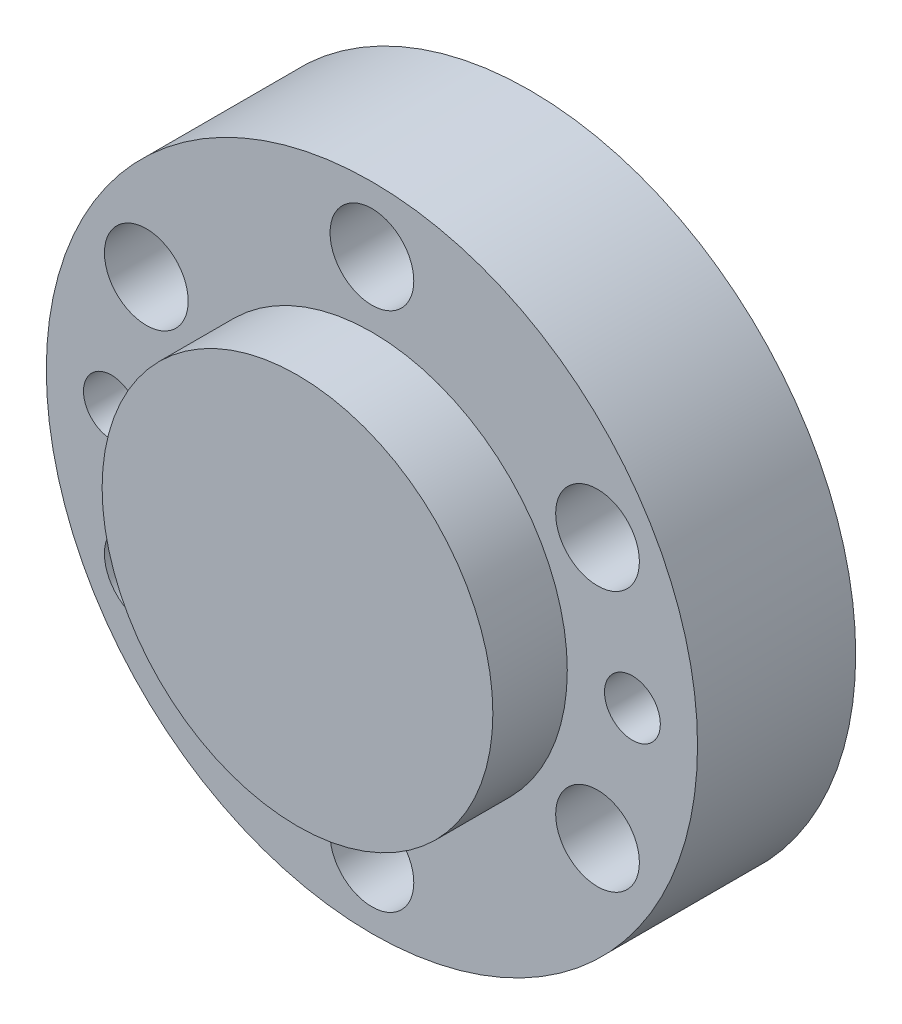
from build123d import *

# Parameters (mm, degrees)
M4_CLEARANCE_HOLE1_D  = 4.5
F_3_0MM_DOWEL_HOLE1_D = 3
SKETCH9_R             = 19
SKETCH9_R_2           = 17.5
CUT_EXTRUDE1_DEPTH    = 29.182441342


with BuildPart() as part:
    # Sketch1 → Revolve1 (revolve)
    with BuildSketch(Plane(origin=(0, 0, 0), x_dir=(1, 0, 0), z_dir=(0, 1, 0))):
        Polygon((19, 8.5), (19, 7.5), (17.5, 7.5), (17.5, 1), (19, 1), (19, 0), (10.5, 0), (10.5, -4), (0, -4), (0, 8.5), align=None)
    revolve(axis=Axis((0, 0, 4), (0, 0, -1)))

    # M4 Clearance Hole1 (through all)
    with Locations(Plane(origin=(0, 0, -8.5), x_dir=(-1, 0, 0), z_dir=(0, 0, -1))):
        with Locations((-12.124355653, 7), (0, 14), (12.124355653, 7), (12.124355653, -7), (0, -14), (-12.124355653, -7)):
            Hole(M4_CLEARANCE_HOLE1_D / 2)

    # Ø3.0mm Dowel Hole1 (through all)
    with Locations(Plane(origin=(0, 0, -8.5), x_dir=(-1, 0, 0), z_dir=(0, 0, -1))):
        with Locations((14, 0), (-14, 0)):
            Hole(F_3_0MM_DOWEL_HOLE1_D / 2)

    # Sketch9 → Cut-Extrude1 (cut, through all)
    with BuildSketch(Plane.XY):
        Circle(SKETCH9_R)
        Circle(SKETCH9_R_2, mode=Mode.SUBTRACT)
    extrude(amount=-CUT_EXTRUDE1_DEPTH, mode=Mode.SUBTRACT)


solid = part.part
